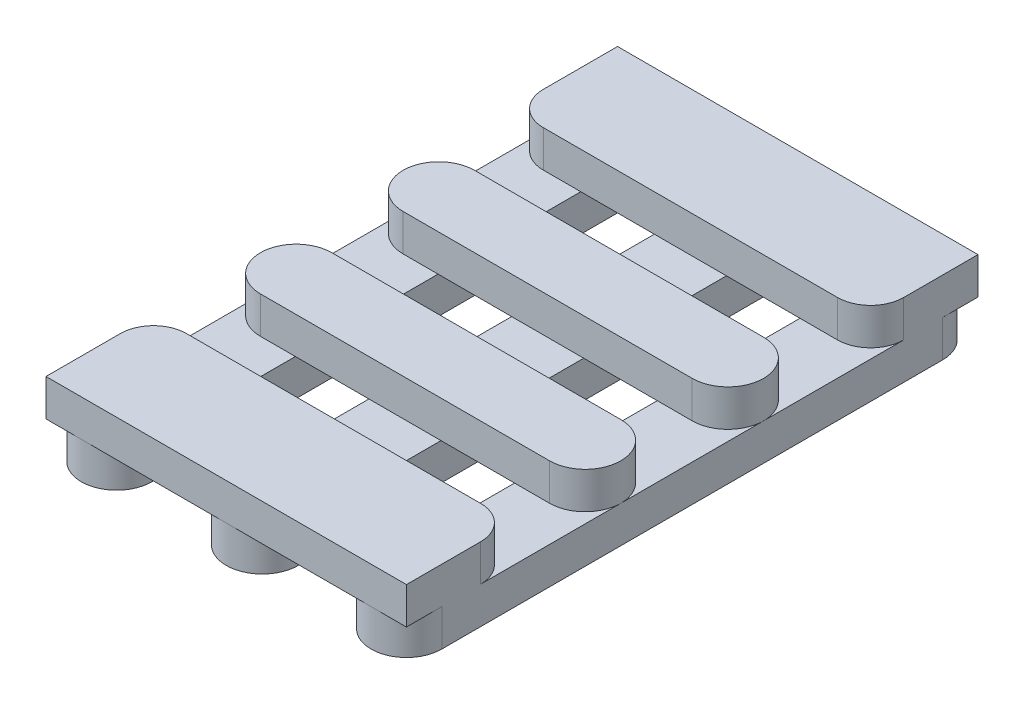
from build123d import *

# Parameters (mm, degrees)
BOSS_EXTRUDE1_DEPTH      = 10
CUT_EXTRUDE3_DEPTH       = 5
BOSS_EXTRUDE6_DEPTH      = 5
BOSS_EXTRUDE6_DEPTH_BACK = 10
SKETCH5_W                = 4.5
SKETCH5_H                = 5
CUT_EXTRUDE5_DEPTH       = 60
CUT_EXTRUDE7_DEPTH       = 5


with BuildPart() as part:
    # Sketch1 → Boss-Extrude1 (new body)
    with BuildSketch(Plane(origin=(0, 0, 0), x_dir=(1, 0, 0), z_dir=(0, 1, 0))):
        with BuildLine():
            Line((-23.3656, -38.85), (16.6344, -38.85))
            ThreePointArc((16.6344, -38.85), (19.816380515, -37.531980515), (21.1344, -34.35))
            Line((21.1344, -34.35), (21.1344, 34.35))
            ThreePointArc((21.1344, 34.35), (19.816380515, 37.531980515), (16.6344, 38.85))
            Line((16.6344, 38.85), (-23.3656, 38.85))
            ThreePointArc((-23.3656, 38.85), (-26.547580515, 37.531980515), (-27.8656, 34.35))
            Line((-27.8656, 34.35), (-27.8656, -34.35))
            ThreePointArc((-27.8656, -34.35), (-26.547580515, -37.531980515), (-23.3656, -38.85))
        make_face()
    extrude(amount=BOSS_EXTRUDE1_DEPTH)

    # Sketch2 → Cut-Extrude3 (cut)
    with BuildSketch(Plane(origin=(0, 10, 0), x_dir=(1, 0, 0), z_dir=(0, 1, 0))):
        with BuildLine():
            Line((-23.0156, -14.55), (-27.8656, -14.55))
            Line((-27.8656, -14.55), (-27.8656, -28.75))
            ThreePointArc((-27.8656, -28.75), (-26.547580515, -25.568019485), (-23.3656, -24.25))
            Line((-23.3656, -24.25), (16.6344, -24.25))
            ThreePointArc((16.6344, -24.25), (19.816380515, -25.568019485), (21.1344, -28.75))
            Line((21.1344, -28.75), (21.1344, -14.55))
            Line((21.1344, -14.55), (16.2844, -14.55))
            Line((16.2844, -14.55), (-23.0156, -14.55))
        make_face()
        with BuildLine():
            ThreePointArc((-23.0156, -14.55), (-26.445067903, -13.129467874), (-27.8656, -9.699999958))
            Line((-27.8656, -9.699999958), (-27.8656, -14.55))
            Line((-27.8656, -14.55), (-23.0156, -14.55))
        make_face()
        with BuildLine():
            Line((21.1344, -14.55), (21.1344, -9.7))
            ThreePointArc((21.1344, -9.7), (19.713867889, -13.129467889), (16.2844, -14.55))
            Line((16.2844, -14.55), (21.1344, -14.55))
        make_face()
        with BuildLine():
            Line((21.1344, -9.7), (21.1344, -4.85))
            Line((21.1344, -4.85), (16.28440001, -4.85))
            ThreePointArc((16.28440001, -4.85), (19.713867892, -6.270532115), (21.1344, -9.7))
        make_face()
        with BuildLine():
            Line((-23.0156, -4.85), (-27.8656, -4.85))
            Line((-27.8656, -4.85), (-27.8656, -9.699999958))
            ThreePointArc((-27.8656, -9.699999958), (-26.445067874, -6.270532097), (-23.0156, -4.85))
        make_face()
        Polygon((-23.0156, 4.85), (-27.8656, 4.85), (-27.8656, -4.85), (-23.0156, -4.85), (16.28440001, -4.85), (21.1344, -4.85), (21.1344, 4.85), (16.284399974, 4.85), align=None)
        with BuildLine():
            ThreePointArc((-23.0156, 4.85), (-26.445067902, 6.270532124), (-27.8656, 9.700000036))
            Line((-27.8656, 9.700000036), (-27.8656, 4.85))
            Line((-27.8656, 4.85), (-23.0156, 4.85))
        make_face()
        with BuildLine():
            Line((21.1344, 4.85), (21.1344, 9.7))
            ThreePointArc((21.1344, 9.7), (19.71386788, 6.270532102), (16.284399974, 4.85))
            Line((16.284399974, 4.85), (21.1344, 4.85))
        make_face()
        with BuildLine():
            Line((-23.015600011, 14.55), (-27.8656, 14.55))
            Line((-27.8656, 14.55), (-27.8656, 9.700000036))
            ThreePointArc((-27.8656, 9.700000036), (-26.44506788, 13.129467898), (-23.015600011, 14.55))
        make_face()
        with BuildLine():
            Line((16.6344, 24.25), (-23.3656, 24.25))
            ThreePointArc((-23.3656, 24.25), (-26.547580515, 25.568019485), (-27.8656, 28.75))
            Line((-27.8656, 28.75), (-27.8656, 14.55))
            Line((-27.8656, 14.55), (-23.015600011, 14.55))
            Line((-23.015600011, 14.55), (16.2844, 14.55))
            Line((16.2844, 14.55), (21.1344, 14.55))
            Line((21.1344, 14.55), (21.1344, 28.75))
            ThreePointArc((21.1344, 28.75), (19.816380515, 25.568019485), (16.6344, 24.25))
        make_face()
        with BuildLine():
            Line((21.1344, 9.7), (21.1344, 14.55))
            Line((21.1344, 14.55), (16.2844, 14.55))
            ThreePointArc((16.2844, 14.55), (19.713867889, 13.129467889), (21.1344, 9.7))
        make_face()
    extrude(amount=-CUT_EXTRUDE3_DEPTH, mode=Mode.SUBTRACT)

    # Sketch4 → Boss-Extrude6 (add, two sides: drawn at the far end of the back side and taken through both)
    with BuildSketch(Plane.XZ.offset(-BOSS_EXTRUDE6_DEPTH_BACK)):
        with BuildLine():
            ThreePointArc((-27.8656, 34.35), (-26.547580515, 37.531980515), (-23.3656, 38.85))
            Line((-23.3656, 38.85), (-27.8656, 38.85))
            Line((-27.8656, 38.85), (-27.8656, 34.35))
        make_face()
        with BuildLine():
            Line((-23.3656, 35.615611346), (-23.3656, 38.85))
            ThreePointArc((-23.3656, 38.85), (-26.547580515, 37.531980515), (-27.8656, 34.35))
            Line((-27.8656, 34.35), (-27.8656, 34.176611106))
            Line((-27.8656, 34.176611106), (-23.3656, 35.615611346))
        make_face()
        with BuildLine():
            Line((17.428758808, 36.847416441), (16.6344, 38.85))
            ThreePointArc((16.6344, 38.85), (19.816380515, 37.531980515), (21.1344, 34.35))
            Line((21.1344, 34.35), (17.428758808, 36.847416441))
        make_face()
        with BuildLine():
            Line((21.1344, 38.85), (21.1344, 34.35))
            ThreePointArc((21.1344, 34.35), (19.816380515, 37.531980515), (16.6344, 38.85))
            Line((16.6344, 38.85), (21.1344, 38.85))
        make_face()
        with BuildLine():
            Line((16.6344, -34.745010915), (21.1344, -34.35))
            ThreePointArc((21.1344, -34.35), (19.816380515, -37.531980515), (16.6344, -38.85))
            Line((16.6344, -38.85), (16.6344, -34.745010915))
        make_face()
        with BuildLine():
            Line((16.6344, -38.85), (21.1344, -38.85))
            Line((21.1344, -38.85), (21.1344, -34.35))
            ThreePointArc((21.1344, -34.35), (19.816380515, -37.531980515), (16.6344, -38.85))
        make_face()
        with BuildLine():
            Line((-23.3656, -38.85), (-23.156696732, -35.585785164))
            Line((-23.156696732, -35.585785164), (-27.8656, -34.35))
            ThreePointArc((-27.8656, -34.35), (-26.547580515, -37.531980515), (-23.3656, -38.85))
        make_face()
        with BuildLine():
            Line((-27.8656, -34.35), (-27.8656, -38.85))
            Line((-27.8656, -38.85), (-23.3656, -38.85))
            ThreePointArc((-23.3656, -38.85), (-26.547580515, -37.531980515), (-27.8656, -34.35))
        make_face()
    extrude(amount=BOSS_EXTRUDE6_DEPTH + BOSS_EXTRUDE6_DEPTH_BACK)

    # Sketch5 → Cut-Extrude5 (cut)
    with BuildSketch(Plane(origin=(21.1344, 0, 0), x_dir=(0, 0, -1), z_dir=(1, 0, 0))):
        Polygon((34.35, 0), (-34.35, 0), (-34.35, -5), (-38.85, -5), (-38.85, -11.467862175), (41.584838498, -11.467862175), (41.584838498, 0), (38.85, 0), (38.85, -5), (34.35, -5), align=None)
        with Locations((36.6, -2.5)):
            Rectangle(SKETCH5_W, SKETCH5_H)
        with Locations((-36.6, -2.5)):
            Rectangle(SKETCH5_W, SKETCH5_H)
    extrude(amount=-CUT_EXTRUDE5_DEPTH, mode=Mode.SUBTRACT)

    # Sketch6 → Cut-Extrude7 (cut)
    with BuildSketch(Plane.XZ):
        with BuildLine():
            ThreePointArc((-27.8656, 34.05), (-26.45971255, 37.44411255), (-23.0656, 38.85))
            Line((-23.0656, 38.85), (-27.8656, 38.85))
            Line((-27.8656, 38.85), (-27.8656, 34.05))
        make_face()
        with BuildLine():
            Line((-18.2656, 34.05), (-18.2656, 38.85))
            Line((-18.2656, 38.85), (-23.0656, 38.85))
            ThreePointArc((-23.0656, 38.85), (-19.67148745, 37.44411255), (-18.2656, 34.05))
        make_face()
        Polygon((-8.2656, 38.85), (-18.2656, 38.85), (-18.2656, 34.05), (-18.2656, -34.05), (-18.2656, -38.85), (-8.2656, -38.85), (-8.2656, -33.950000026), (-8.2656, 33.95), align=None)
        with BuildLine():
            Line((-3.365599985, 38.85), (-8.2656, 38.85))
            Line((-8.2656, 38.85), (-8.2656, 33.95))
            ThreePointArc((-8.2656, 33.95), (-6.830423222, 37.414823233), (-3.365599985, 38.85))
        make_face()
        with BuildLine():
            Line((1.5344, 38.85), (-3.365599985, 38.85))
            ThreePointArc((-3.365599985, 38.85), (0.099223233, 37.414823222), (1.5344, 33.95))
            Line((1.5344, 33.95), (1.5344, 38.85))
        make_face()
        Polygon((1.5344, 38.85), (1.5344, 33.95), (1.5344, -33.95), (1.5344, -38.85), (11.5344, -38.85), (11.5344, -34.050000018), (11.5344, 34.05), (11.5344, 38.85), align=None)
        with BuildLine():
            Line((16.3344, 38.85), (11.5344, 38.85))
            Line((11.5344, 38.85), (11.5344, 34.05))
            ThreePointArc((11.5344, 34.05), (12.94028745, 37.44411255), (16.3344, 38.85))
        make_face()
        with BuildLine():
            Line((21.1344, 38.85), (16.3344, 38.85))
            ThreePointArc((16.3344, 38.85), (19.72851255, 37.44411255), (21.1344, 34.05))
            Line((21.1344, 34.05), (21.1344, 38.85))
        make_face()
        with BuildLine():
            ThreePointArc((21.1344, -34.05), (19.72851255, -37.44411255), (16.3344, -38.85))
            Line((16.3344, -38.85), (21.1344, -38.85))
            Line((21.1344, -38.85), (21.1344, -34.05))
        make_face()
        with BuildLine():
            Line((11.5344, -34.050000018), (11.5344, -38.85))
            Line((11.5344, -38.85), (16.3344, -38.85))
            ThreePointArc((16.3344, -38.85), (12.940287457, -37.444112556), (11.5344, -34.050000018))
        make_face()
        with BuildLine():
            Line((1.5344, -38.85), (1.5344, -33.95))
            ThreePointArc((1.5344, -33.95), (0.099223245, -37.414823211), (-3.365599951, -38.85))
            Line((-3.365599951, -38.85), (1.5344, -38.85))
        make_face()
        with BuildLine():
            ThreePointArc((-3.365599951, -38.85), (-6.830423201, -37.414823254), (-8.2656, -33.950000026))
            Line((-8.2656, -33.950000026), (-8.2656, -38.85))
            Line((-8.2656, -38.85), (-3.365599951, -38.85))
        make_face()
        with BuildLine():
            Line((-18.2656, -38.85), (-18.2656, -34.05))
            ThreePointArc((-18.2656, -34.05), (-19.67148745, -37.44411255), (-23.0656, -38.85))
            Line((-23.0656, -38.85), (-18.2656, -38.85))
        make_face()
        with BuildLine():
            ThreePointArc((-23.0656, -38.85), (-26.459712556, -37.444112543), (-27.8656, -34.049999982))
            Line((-27.8656, -34.049999982), (-27.8656, -38.85))
            Line((-27.8656, -38.85), (-23.0656, -38.85))
        make_face()
    extrude(amount=-CUT_EXTRUDE7_DEPTH, mode=Mode.SUBTRACT)


solid = part.part
